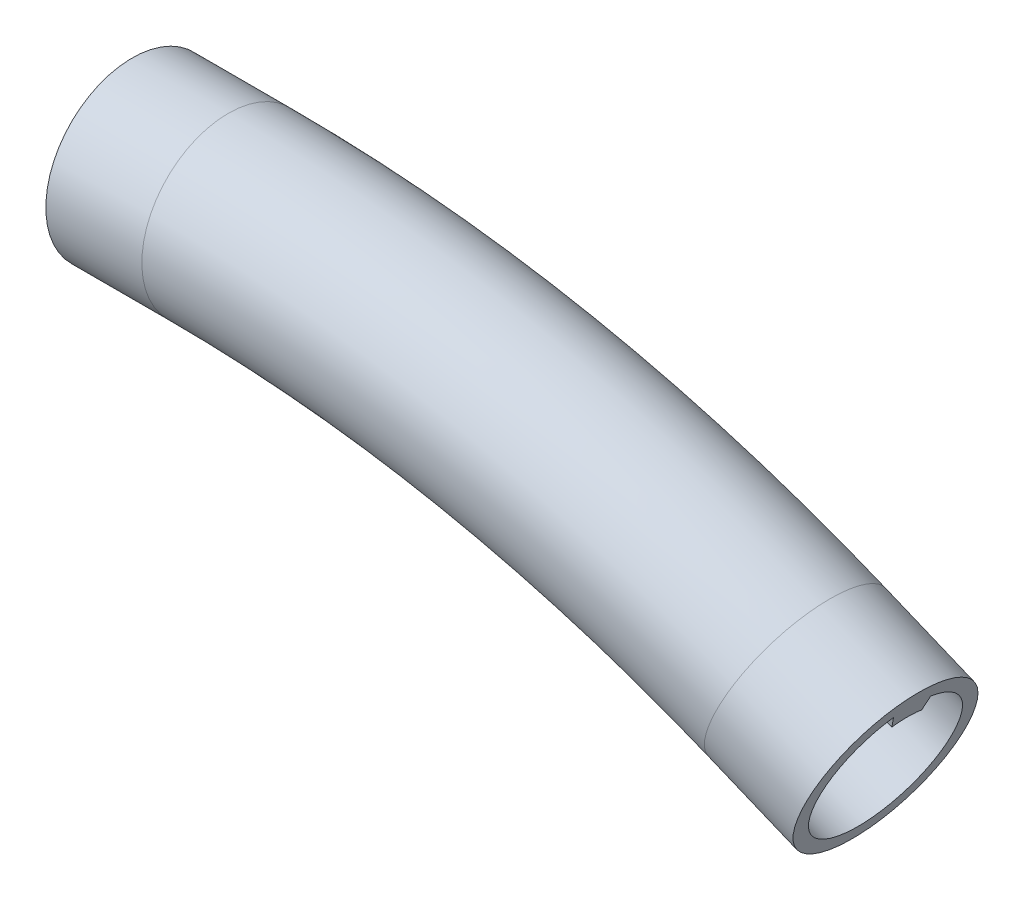
from build123d import *

# Parameters (mm, degrees)
SKETCH3_R                       = 9
SKETCH3_R_2                     = 7.5
BOSS_EXTRUDE3_START             = -5
BOSS_EXTRUDE3_DEPTH             = 5
BOSS_EXTRUDE4_DEPTH             = 5
BOSS_EXTRUDE5_REACH             = 138.641
BOSS_EXTRUDE5_DIRECTION_2_REACH = 138.641


with BuildPart() as part:
    # Sweep1: sweep along a path in Sketch2path
    with BuildLine(Plane.XY) as sweep1_path:
        Line((78.462822432, 84.392774239), (69.224027107, 88.219608562))
        ThreePointArc((69.224027107, 88.219608562), (40.192147196, 97.026333052), (10, 100))
        Line((10, 100), (0, 100))
    # Sketch3 → Sweep1 (sweep)
    with BuildSketch(Plane(origin=(0, 0, 0), x_dir=(0, 0, -1), z_dir=(1, 0, 0))):
        with Locations((0, 100)):
            Circle(SKETCH3_R)
        with Locations((0, 100)):
            Circle(SKETCH3_R_2, mode=Mode.SUBTRACT)
    sweep(path=sweep1_path.line)

    # Sketch9 → Boss-Extrude3 (add)
    with BuildSketch(Plane(origin=(37.134856649, -15.381761261, 0), x_dir=(0, 0, -1), z_dir=(0.9238795325112893, -0.3826834323650841, 0)).offset(BOSS_EXTRUDE3_START)):
        with BuildLine():
            Line((-1.552914271, 113.79073397), (-1.941142838, 115.23962271))
            ThreePointArc((-1.941142838, 115.23962271), (0, 115.495179012), (1.941142838, 115.23962271))
            Line((1.941142838, 115.23962271), (1.552914271, 113.79073397))
            ThreePointArc((1.552914271, 113.79073397), (0, 113.995179012), (-1.552914271, 113.79073397))
        make_face()
    extrude(amount=BOSS_EXTRUDE3_DEPTH)

    # Sketch10 → Boss-Extrude4 (add)
    with BuildSketch(Plane.ZY):
        with BuildLine():
            Line((-1.552914271, 105.795554958), (-1.941142838, 107.244443697))
            ThreePointArc((-1.941142838, 107.244443697), (0, 107.5), (1.941142838, 107.244443697))
            Line((1.941142838, 107.244443697), (1.552914271, 105.795554958))
            ThreePointArc((1.552914271, 105.795554958), (0, 106), (-1.552914271, 105.795554958))
        make_face()
    extrude(amount=-BOSS_EXTRUDE4_DEPTH)

    # Sketch12 → Boss-Extrude5 (add, up to next)
    with BuildSketch(Plane.XY, mode=Mode.PRIVATE) as boss_extrude5_sk1:
        with BuildLine():
            Line((12.570038595, 92.477571613), (12.604943408, 94.477267003))
            ThreePointArc((12.604943408, 94.477267003), (14.558173623, 94.430383842), (16.510622818, 94.357937705))
            Line((16.510622818, 94.357937705), (16.423384043, 92.359841262))
            ThreePointArc((16.423384043, 92.359841262), (14.497096597, 92.431316661), (12.570038595, 92.477571613))
        make_face()
    boss_extrude5_tool1 = extrude(boss_extrude5_sk1.sketch, amount=BOSS_EXTRUDE5_REACH, mode=Mode.PRIVATE) - part.part
    # Sketch12 → Boss-Extrude5 (add, up to next)
    with BuildSketch(Plane.XY, mode=Mode.PRIVATE) as boss_extrude5_sk2:
        with BuildLine():
            Line((63.970912336, 82.253302132), (64.70391479, 84.114137268))
            ThreePointArc((64.70391479, 84.114137268), (62.881423963, 84.818291718), (61.049872177, 85.498530174))
            Line((61.049872177, 85.498530174), (60.36583189, 83.619144932))
            ThreePointArc((60.36583189, 83.619144932), (62.172841887, 82.948021298), (63.970912336, 82.253302132))
        make_face()
    boss_extrude5_tool2 = extrude(boss_extrude5_sk2.sketch, amount=BOSS_EXTRUDE5_REACH, mode=Mode.PRIVATE) - part.part
    # Sketch12 → Boss-Extrude5 (add, up to next)
    with BuildSketch(Plane.XY, mode=Mode.PRIVATE) as boss_extrude5_sk3:
        with BuildLine():
            Line((39.542068537, 104.788027012), (39.177935695, 102.821454544))
            ThreePointArc((39.177935695, 102.821454544), (41.238111377, 102.426026794), (43.29293457, 102.003666055))
            Line((43.29293457, 102.003666055), (43.708421499, 103.960032742))
            ThreePointArc((43.708421499, 103.960032742), (41.627954662, 104.38766443), (39.542068537, 104.788027012))
        make_face()
    boss_extrude5_tool3 = extrude(boss_extrude5_sk3.sketch, amount=BOSS_EXTRUDE5_REACH, mode=Mode.PRIVATE) - part.part
    add(boss_extrude5_tool1.solids().sort_by_distance((14.527574, 93.428865, 0))[0])
    add(boss_extrude5_tool2.solids().sort_by_distance((62.526429, 83.8813, 0))[0])
    add(boss_extrude5_tool3.solids().sort_by_distance((41.432538, 103.404356, 0))[0])

    # Sketch12 → Boss-Extrude5 direction 2 (add, up to next)
    with BuildSketch(Plane.XY, mode=Mode.PRIVATE) as boss_extrude5_direction_2_sk1:
        with BuildLine():
            Line((12.570038595, 92.477571613), (12.604943408, 94.477267003))
            ThreePointArc((12.604943408, 94.477267003), (14.558173623, 94.430383842), (16.510622818, 94.357937705))
            Line((16.510622818, 94.357937705), (16.423384043, 92.359841262))
            ThreePointArc((16.423384043, 92.359841262), (14.497096597, 92.431316661), (12.570038595, 92.477571613))
        make_face()
    boss_extrude5_direction_2_tool1 = extrude(boss_extrude5_direction_2_sk1.sketch, amount=-BOSS_EXTRUDE5_DIRECTION_2_REACH, mode=Mode.PRIVATE) - part.part
    # Sketch12 → Boss-Extrude5 direction 2 (add, up to next)
    with BuildSketch(Plane.XY, mode=Mode.PRIVATE) as boss_extrude5_direction_2_sk2:
        with BuildLine():
            Line((63.970912336, 82.253302132), (64.70391479, 84.114137268))
            ThreePointArc((64.70391479, 84.114137268), (62.881423963, 84.818291718), (61.049872177, 85.498530174))
            Line((61.049872177, 85.498530174), (60.36583189, 83.619144932))
            ThreePointArc((60.36583189, 83.619144932), (62.172841887, 82.948021298), (63.970912336, 82.253302132))
        make_face()
    boss_extrude5_direction_2_tool2 = extrude(boss_extrude5_direction_2_sk2.sketch, amount=-BOSS_EXTRUDE5_DIRECTION_2_REACH, mode=Mode.PRIVATE) - part.part
    # Sketch12 → Boss-Extrude5 direction 2 (add, up to next)
    with BuildSketch(Plane.XY, mode=Mode.PRIVATE) as boss_extrude5_direction_2_sk3:
        with BuildLine():
            Line((39.542068537, 104.788027012), (39.177935695, 102.821454544))
            ThreePointArc((39.177935695, 102.821454544), (41.238111377, 102.426026794), (43.29293457, 102.003666055))
            Line((43.29293457, 102.003666055), (43.708421499, 103.960032742))
            ThreePointArc((43.708421499, 103.960032742), (41.627954662, 104.38766443), (39.542068537, 104.788027012))
        make_face()
    boss_extrude5_direction_2_tool3 = extrude(boss_extrude5_direction_2_sk3.sketch, amount=-BOSS_EXTRUDE5_DIRECTION_2_REACH, mode=Mode.PRIVATE) - part.part
    add(boss_extrude5_direction_2_tool1.solids().sort_by_distance((14.527574, 93.428865, 0))[0])
    add(boss_extrude5_direction_2_tool2.solids().sort_by_distance((62.526429, 83.8813, 0))[0])
    add(boss_extrude5_direction_2_tool3.solids().sort_by_distance((41.432538, 103.404356, 0))[0])


solid = part.part
